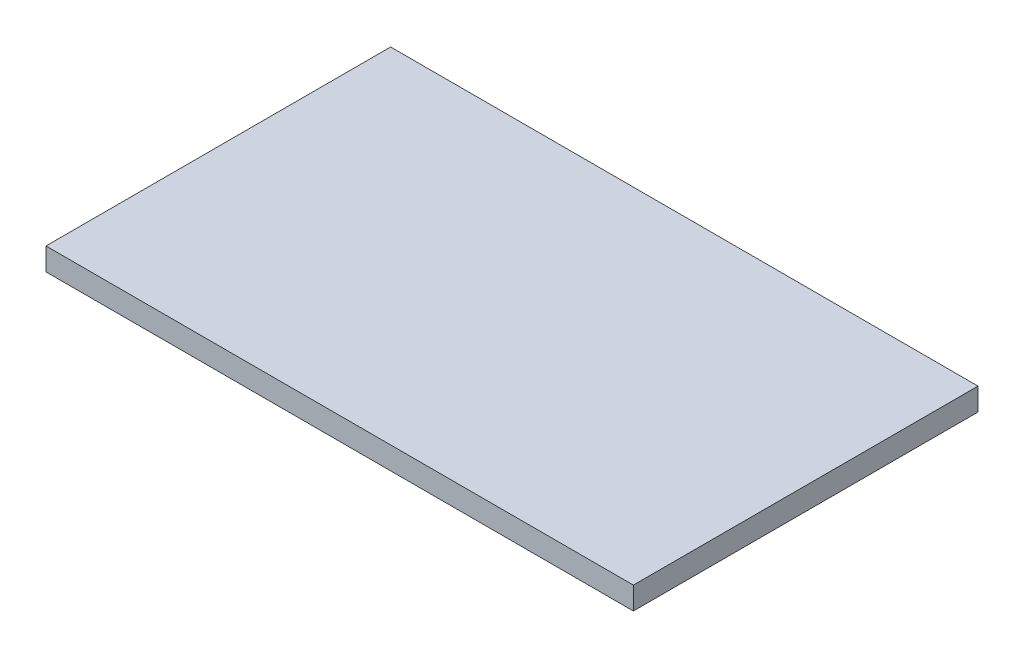
from build123d import *

# Parameters (mm, degrees)
SKETCH_1_W      = 78.4
SKETCH_1_H      = 46
EXTRUDE_1_DEPTH = 3


with BuildPart() as part:
    # 草圖1 → 填料-伸長1 (new body)
    with BuildSketch(Plane(origin=(0, 0, 0), x_dir=(1, 0, 0), z_dir=(0, 1, 0))):
        Rectangle(SKETCH_1_W, SKETCH_1_H)
    extrude(amount=EXTRUDE_1_DEPTH)


solid = part.part
